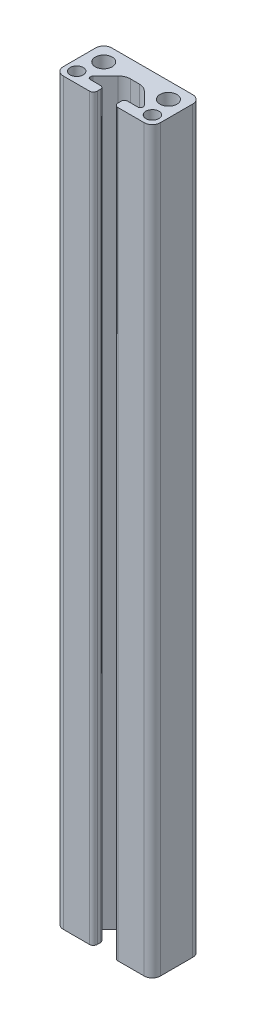
from build123d import *

# Parameters (mm, degrees)
SKETCH16_R                = 3.3274
SKETCH16_R_2              = 2.5527
F_15_1575_PROFILE_1_DEPTH = 290


with BuildPart() as part:
    # Sketch16 → 15 1575 PROFILE(1) (new body)
    with BuildSketch(Plane.XZ.offset(-145)):
        with BuildLine():
            Line((-9.398, 5.461), (-5.334, 5.461))
            ThreePointArc((-5.334, 5.461), (-4.435974388, 5.832974388), (-4.064, 6.731))
            Line((-4.064, 6.731), (-4.064, 8.001))
            ThreePointArc((-4.064, 8.001), (-4.510369265, 9.078630735), (-5.588, 9.525))
            Line((-5.588, 9.525), (-15.875, 9.525))
            ThreePointArc((-15.875, 9.525), (-18.12006403, 8.59506403), (-19.05, 6.35))
            Line((-19.05, 6.35), (-19.05, -6.35))
            ThreePointArc((-19.05, -6.35), (-18.12006403, -8.59506403), (-15.875, -9.525))
            Line((-15.875, -9.525), (15.875, -9.525))
            ThreePointArc((15.875, -9.525), (18.12006403, -8.59506403), (19.05, -6.35))
            Line((19.05, -6.35), (19.05, 6.35))
            ThreePointArc((19.05, 6.35), (18.12006403, 8.59506403), (15.875, 9.525))
            Line((15.875, 9.525), (5.588, 9.525))
            ThreePointArc((5.588, 9.525), (4.510369265, 9.078630735), (4.064, 8.001))
            Line((4.064, 8.001), (4.064, 6.731))
            ThreePointArc((4.064, 6.731), (4.435974388, 5.832974388), (5.334, 5.461))
            Line((5.334, 5.461), (9.398, 5.461))
            ThreePointArc((9.398, 5.461), (10.026617928, 5.200617928), (10.287, 4.572))
            Line((10.287, 4.572), (10.287, 4.255364987))
            ThreePointArc((10.287, 4.255364987), (10.219328904, 3.915159416), (10.026617928, 3.626747059))
            Line((10.026617928, 3.626747059), (5.124055081, -1.275815789))
            ThreePointArc((5.124055081, -1.275815789), (3.583109058, -2.305443004), (1.765439291, -2.667))
            Line((1.765439291, -2.667), (-1.765439291, -2.667))
            ThreePointArc((-1.765439291, -2.667), (-3.583109058, -2.305443004), (-5.124055081, -1.275815789))
            Line((-5.124055081, -1.275815789), (-10.026617928, 3.626747059))
            ThreePointArc((-10.026617928, 3.626747059), (-10.219328904, 3.915159416), (-10.287, 4.255364987))
            Line((-10.287, 4.255364987), (-10.287, 4.572))
            ThreePointArc((-10.287, 4.572), (-10.026617928, 5.200617928), (-9.398, 5.461))
        make_face()
        with Locations((-12.7, -3.175)):
            Circle(SKETCH16_R, mode=Mode.SUBTRACT)
        with Locations((-14.848796959, 5.276432773)):
            Circle(SKETCH16_R_2, mode=Mode.SUBTRACT)
        with Locations((12.7, -3.175)):
            Circle(SKETCH16_R, mode=Mode.SUBTRACT)
        with Locations((14.848796959, 5.276432773)):
            Circle(SKETCH16_R_2, mode=Mode.SUBTRACT)
    extrude(amount=F_15_1575_PROFILE_1_DEPTH)


solid = part.part
